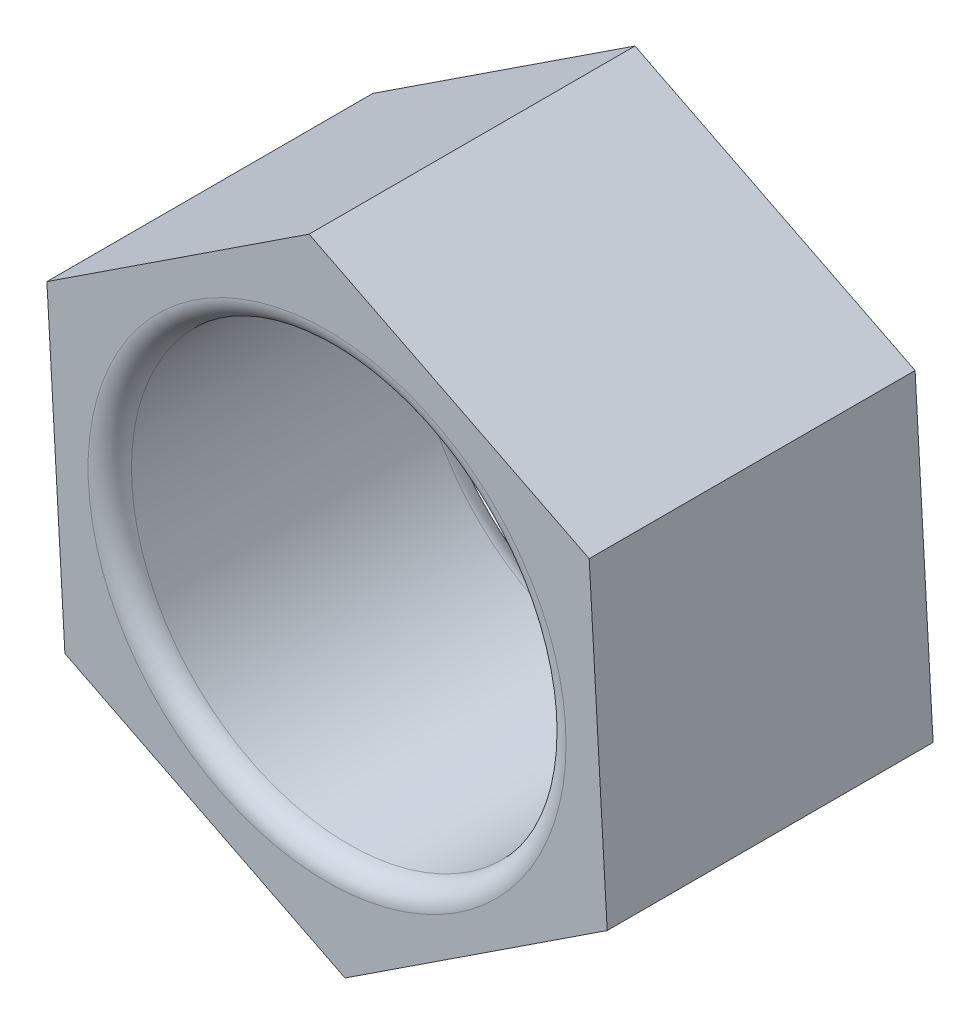
from build123d import *

# Parameters (mm, degrees)
BOSS_EXTRUDE1_DEPTH     = 1.5
CUT_EXTRUDE1_DEPTH      = 3.447232626
CUT_EXTRUDE1_DEPTH_BACK = 3.447232626
SKETCH2_R               = 1
FILLET1_R               = 0.1


with BuildPart() as part:
    # Sketch1 → Boss-Extrude1 (new body)
    with BuildSketch(Plane.XY):
        Polygon((-0.082868712, 1.440994833), (-1.289372489, 0.648731007), (-1.206503776, -0.792263827), (0.082868712, -1.440994833), (1.289372489, -0.648731007), (1.206503776, 0.792263827), align=None)
    extrude(amount=BOSS_EXTRUDE1_DEPTH)

    # Sketch2 → Cut-Extrude1 (cut, two sides: drawn at the far end of the back side and taken through both)
    with BuildSketch(Plane.XY.offset(1.5).offset(-CUT_EXTRUDE1_DEPTH_BACK)):
        Circle(SKETCH2_R)
    extrude(amount=CUT_EXTRUDE1_DEPTH + CUT_EXTRUDE1_DEPTH_BACK, mode=Mode.SUBTRACT)

    # Fillet1
    fillet1_edges = [part.edges().sort_by_distance(p)[0] for p in [
        (-1, 0, 1.5),
        (-1, 0, 0),
    ]]
    fillet(fillet1_edges, radius=FILLET1_R)


solid = part.part
